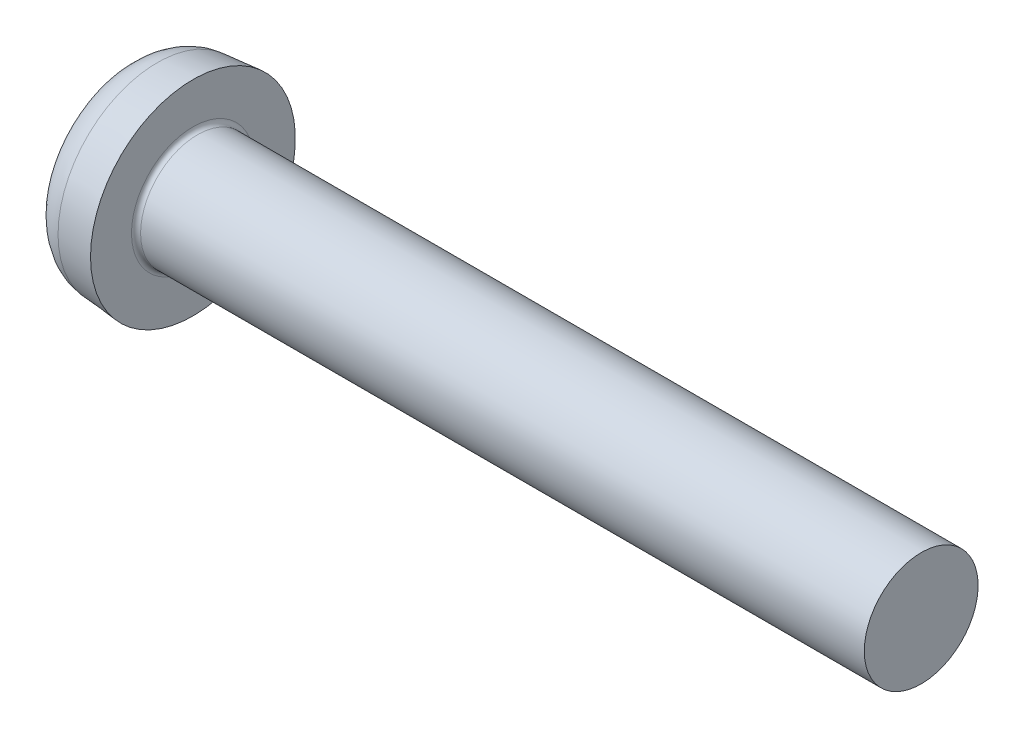
from build123d import *

# Parameters (mm, degrees)
FILLET1_R    = 0.1
RECPAT_COUNT = 2
RECPAT_ANGLE = 90


with BuildPart() as part:
    # BodySke → BaseBody (revolve)
    with BuildSketch(Plane.XY, mode=Mode.PRIVATE) as basebody_sk:
        with BuildLine():
            Line((1.7, 1.25), (1.7, 2.25))
            Line((1.7, 2.25), (0.918010196, 2.181584757))
            ThreePointArc((0.918010196, 2.181584757), (0.475876178, 1.999446664), (0.216617065, 1.597648845))
            ThreePointArc((0.216617065, 1.597648845), (0.054400888, 0.806133485), (0, 0))
            Line((0, 0), (17.7, 0))
            Line((17.7, 0), (17.7, 1.25))
            Line((17.7, 1.25), (1.7, 1.25))
        make_face()
    revolve(basebody_sk.sketch.rotate(Axis((0, 0, 0), (1, 0, 0)), 90), axis=Axis((0, 0, 0), (1, 0, 0)))

    # Fillet1
    fillet1_edges = [part.edges().sort_by_distance(p)[0] for p in [
        (1.7, 0, -1.25),
    ]]
    fillet(fillet1_edges, radius=FILLET1_R)

    # RecSkeTop → Recess section 0
    with BuildSketch(Plane(origin=(0, 0, 0), x_dir=(0, 0, -1), z_dir=(1, 0, 0))):
        with BuildLine():
            Line((-0.286, 1.3), (0.286, 1.3))
            Line((0.286, 1.3), (0.286, -1.3))
            Line((0.286, -1.3), (-0.286, -1.3))
            Line((-0.286, -1.3), (-0.286, 1.3))
        make_face()
    # RecSkeBot → Recess section 1
    with BuildSketch(Plane(origin=(1.42, 0, 0), x_dir=(0, 0, -1), z_dir=(1, 0, 0))):
        with BuildLine():
            Line((-0.286, 0.592014235), (0.286, 0.592014235))
            Line((0.286, 0.592014235), (0.286, -0.592014235))
            Line((0.286, -0.592014235), (-0.286, -0.592014235))
            Line((-0.286, -0.592014235), (-0.286, 0.592014235))
        make_face()
    recess = loft(mode=Mode.SUBTRACT)

    # RecPat: Recess ×2 about axis
    recpat_axis = Axis((0, 0, 0), (1, 0, 0))
    for i in range(1, RECPAT_COUNT):
        add(recess.rotate(recpat_axis, i * RECPAT_ANGLE / (RECPAT_COUNT - 1)), mode=Mode.SUBTRACT)

    # RecCorSke → RecessCore (revolve, cut)
    with BuildSketch(Plane.XY, mode=Mode.PRIVATE) as recesscore_sk:
        Polygon((0, 0), (0, 0.6292), (1.42, 0.529903927), (1.592176223, 0), align=None)
    revolve(recesscore_sk.sketch.rotate(Axis((0, 0, 0), (1, 0, 0)), 346.937939467), axis=Axis((0, 0, 0), (1, 0, 0)), mode=Mode.SUBTRACT)


solid = part.part
